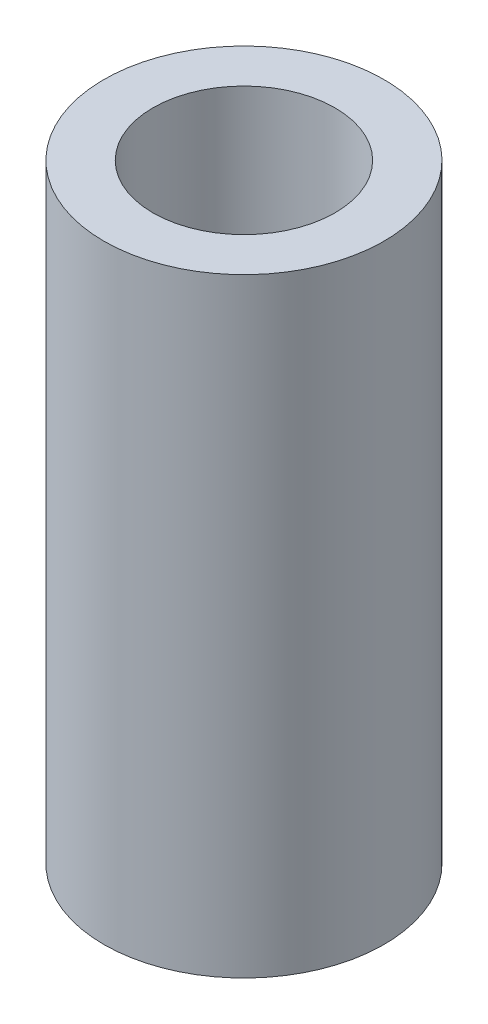
from build123d import *

# Parameters (mm, degrees)
SKETCH1_R           = 2.54
SKETCH1_R_2         = 1.651
BOSS_EXTRUDE1_DEPTH = 11.049


with BuildPart() as part:
    # Sketch1 → Boss-Extrude1 (new body)
    with BuildSketch(Plane(origin=(0, 0, 0), x_dir=(1, 0, 0), z_dir=(0, 1, 0))):
        with Locations(Location((0, 0, 0), (0, 0, 270))):
            Circle(SKETCH1_R)
        with Locations(Location((0, 0, 0), (0, 0, 270))):
            Circle(SKETCH1_R_2, mode=Mode.SUBTRACT)
    extrude(amount=BOSS_EXTRUDE1_DEPTH)


solid = part.part
